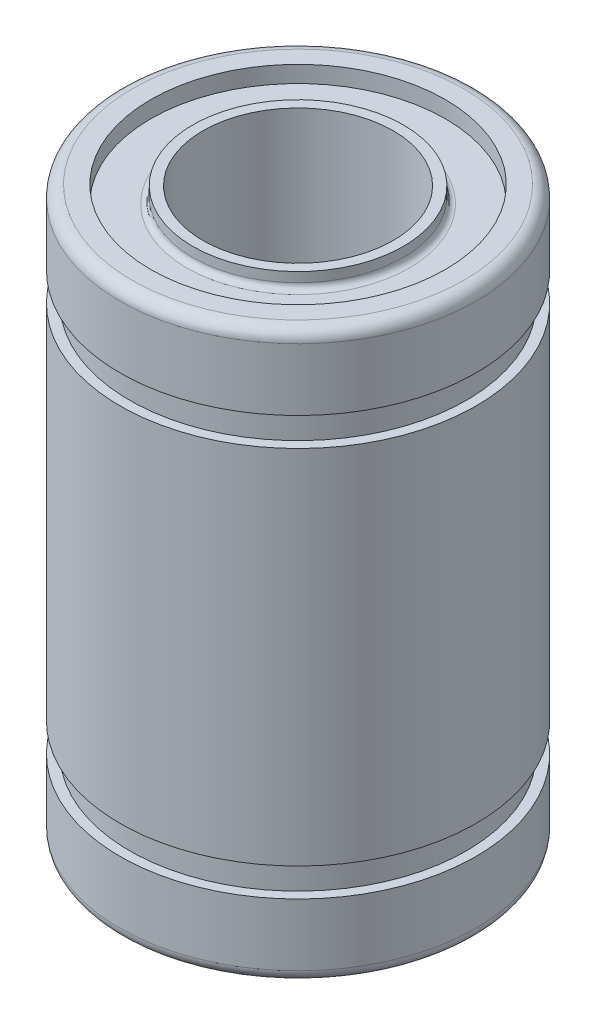
from build123d import *


with BuildPart() as part:
    # Sketch1 → Revolve1 (revolve)
    with BuildSketch(Plane.XY, mode=Mode.PRIVATE) as revolve1_sk:
        with BuildLine():
            Line((4.425, 11.8804), (4, 11.8804))
            Line((4, 11.8804), (4, -11.8804))
            Line((4, -11.8804), (4.425, -11.8804))
            Line((4.425, -11.8804), (4.425, -11.474))
            ThreePointArc((4.425, -11.474), (4.499394878, -11.294394878), (4.679, -11.22))
            Line((4.679, -11.22), (6.19, -11.22))
            Line((6.19, -11.22), (6.19, -11.92))
            Line((6.19, -11.92), (6.972, -11.92))
            ThreePointArc((6.972, -11.92), (7.331210245, -11.771210245), (7.48, -11.412))
            Line((7.48, -11.412), (7.48, -8.8))
            Line((7.48, -8.8), (7.075, -8.8))
            Line((7.075, -8.8), (7.075, -7.6))
            Line((7.075, -7.6), (7.48, -7.6))
            Line((7.48, -7.6), (7.48, 7.6))
            Line((7.48, 7.6), (7.075, 7.6))
            Line((7.075, 7.6), (7.075, 8.8))
            Line((7.075, 8.8), (7.48, 8.8))
            Line((7.48, 8.8), (7.48, 11.412))
            ThreePointArc((7.48, 11.412), (7.331210245, 11.771210245), (6.972, 11.92))
            Line((6.972, 11.92), (6.19, 11.92))
            Line((6.19, 11.92), (6.19, 11.22))
            Line((6.19, 11.22), (4.679, 11.22))
            ThreePointArc((4.679, 11.22), (4.499394878, 11.294394878), (4.425, 11.474))
            Line((4.425, 11.474), (4.425, 11.8804))
        make_face()
    revolve(revolve1_sk.sketch.rotate(Axis((0, 11.921250002, 0), (0, -1, 0)), 270), axis=Axis((0, 11.921250002, 0), (0, -1, 0)))


solid = part.part
